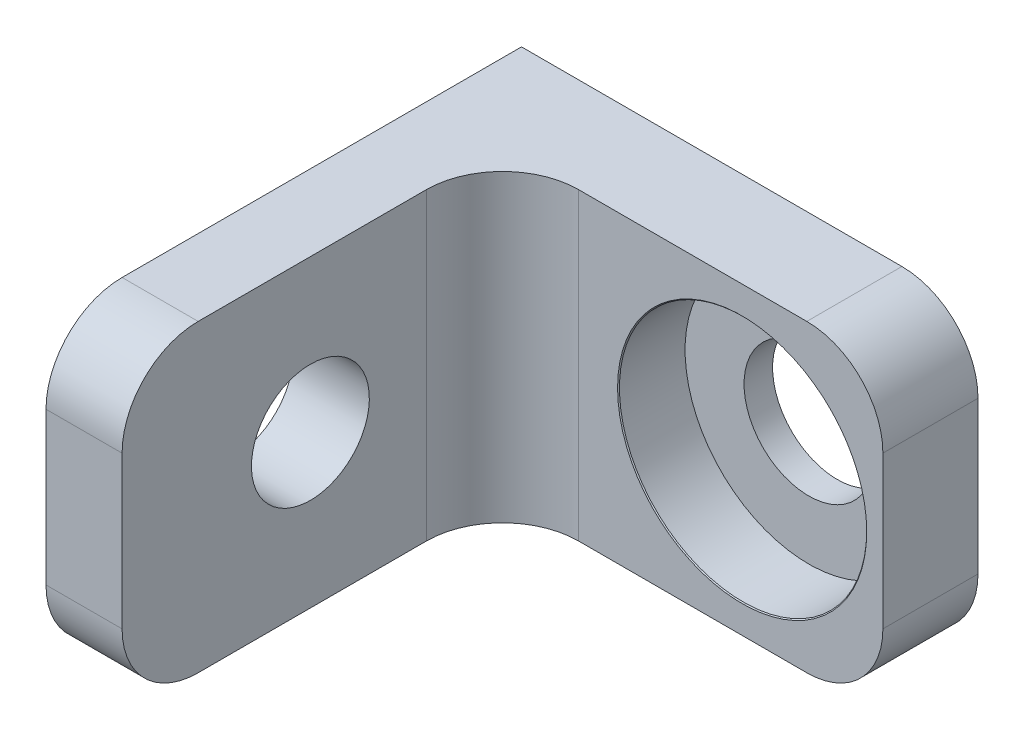
from build123d import *

# Parameters (mm, degrees)
ESBO_O1_W                = 12
ESBO_O1_H                = 8
RESSALTO_EXTRUS_O1_DEPTH = 2.5
ESBO_O3_W                = 2
ESBO_O3_H                = 8
RESSALTO_EXTRUS_O2_DEPTH = 10
FILETE1_R                = 2
FILETE2_R                = 2
CORTE_EXTRUS_O2_REACH    = 19.095
ESBO_O6_R                = 1.55


with BuildPart() as part:
    # Esboço1 → Ressalto-extrusão1 (new body)
    with BuildSketch(Plane.XY):
        with Locations((-6, 2)):
            Rectangle(ESBO_O1_W, ESBO_O1_H)
    extrude(amount=RESSALTO_EXTRUS_O1_DEPTH)

    # Esboço3 → Ressalto-extrusão2 (add)
    with BuildSketch(Plane.XY.offset(2.5)):
        with Locations((-11, 2)):
            Rectangle(ESBO_O3_W, ESBO_O3_H)
    extrude(amount=RESSALTO_EXTRUS_O2_DEPTH)

    # Esboço10 → Rebaixo para parafuso com cabeça redonda de M33 (revolve, cut)
    with BuildSketch(Plane(origin=(-3.7, 2, 2.5), x_dir=(0, -1, 0), z_dir=(1, 0, 0))):
        Polygon((0, 0), (0, 2.5), (1.7, 2.5), (1.7, 1.75), (3.25, 1.75), (3.25, 0.025), (3.275, 0), align=None)
    revolve(axis=Axis((-3.7, 2, 8.85), (0, 0, -1)), mode=Mode.SUBTRACT)

    # Filete1
    filete1_edges = [part.edges().sort_by_distance(p)[0] for p in [
        (-10, 2, 2.5),
    ]]
    fillet(filete1_edges, radius=FILETE1_R)

    # Filete2
    filete2_edges = [part.edges().sort_by_distance(p)[0] for p in [
        (-11, -2, 12.5),
        (-11, 6, 12.5),
        (0, 6, 1.25),
        (0, -2, 1.25),
    ]]
    fillet(filete2_edges, radius=FILETE2_R)

    # Esboço6 → Corte-extrusão2 (cut, up to next)
    with BuildSketch(Plane(origin=(-10, 0, 0), x_dir=(0, 0, -1), z_dir=(1, 0, 0)), mode=Mode.PRIVATE) as corte_extrus_o2_sk1:
        with Locations(Location((-7.55, 2, 0), (0, 0, 90))):
            Circle(ESBO_O6_R)
    corte_extrus_o2_tool1 = extrude(corte_extrus_o2_sk1.sketch, amount=-CORTE_EXTRUS_O2_REACH, mode=Mode.PRIVATE) & part.part
    add(corte_extrus_o2_tool1.solids().sort_by_distance((-10, 2, 7.55))[0], mode=Mode.SUBTRACT)


solid = part.part
